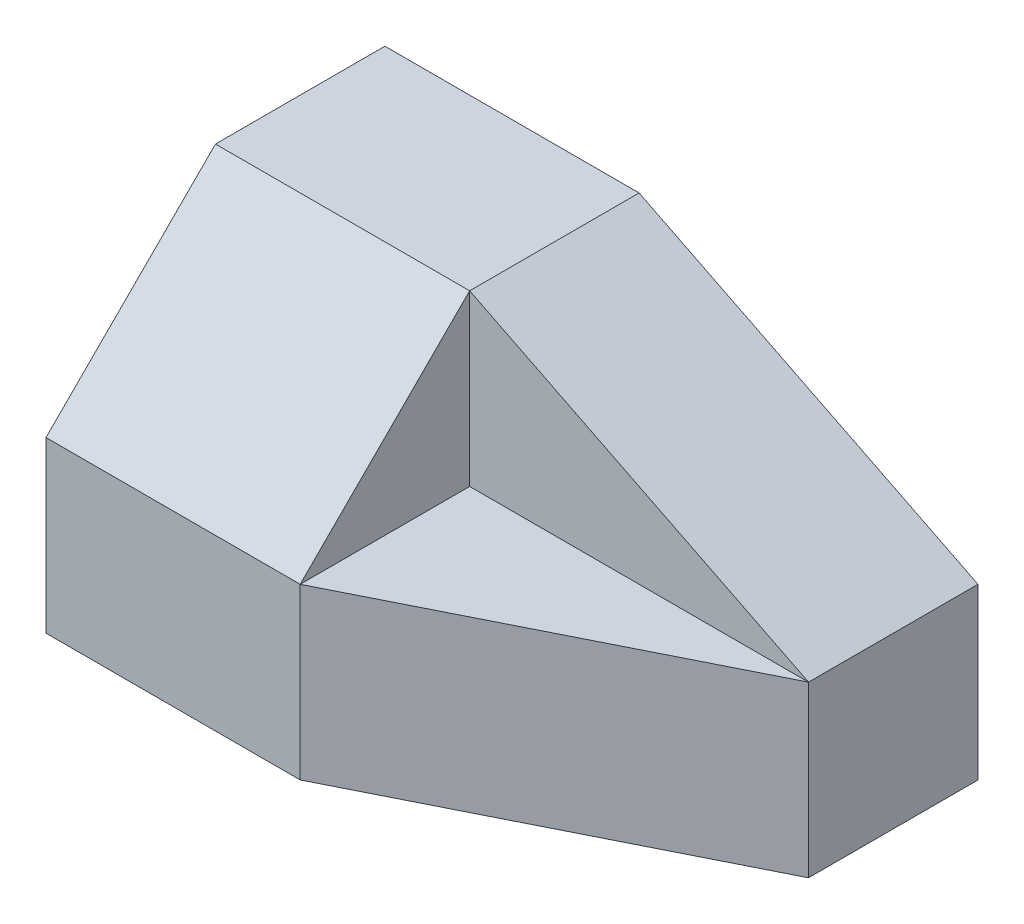
from build123d import *

# Parameters (mm, degrees)
EXTRUDE_1_DEPTH = 2
SKETCH_3_W      = 2
SKETCH_3_H      = 2
EXTRUDE_2_DEPTH = 3
EXTRUDE_3_DEPTH = 2
EXTRUDE_4_DEPTH = 3


with BuildPart() as part:
    # 草圖1 → 填料-伸長1 (new body)
    with BuildSketch(Plane(origin=(0, 0, 0), x_dir=(1, 0, 0), z_dir=(0, 1, 0))):
        Polygon((0, 0), (0, 4), (7, 4), (7, 2), (3, 0), align=None)
    extrude(amount=EXTRUDE_1_DEPTH)

    # 草圖3 → 填料-伸長2 (add)
    with BuildSketch(Plane.ZY):
        with Locations((-3, 3)):
            Rectangle(SKETCH_3_W, SKETCH_3_H)
    extrude(amount=-EXTRUDE_2_DEPTH)

    # 草圖4 → 填料-伸長3 (add)
    with BuildSketch(Plane(origin=(0, 0, -4), x_dir=(-1, 0, 0), z_dir=(0, 0, -1))):
        Polygon((-7, 2), (-3, 4), (-3, 2), align=None)
    extrude(amount=-EXTRUDE_3_DEPTH)

    # 草圖5 → 填料-伸長4 (add)
    with BuildSketch(Plane.ZY):
        Polygon((-2, 4), (0, 2), (-2, 2), align=None)
    extrude(amount=-EXTRUDE_4_DEPTH)


solid = part.part
